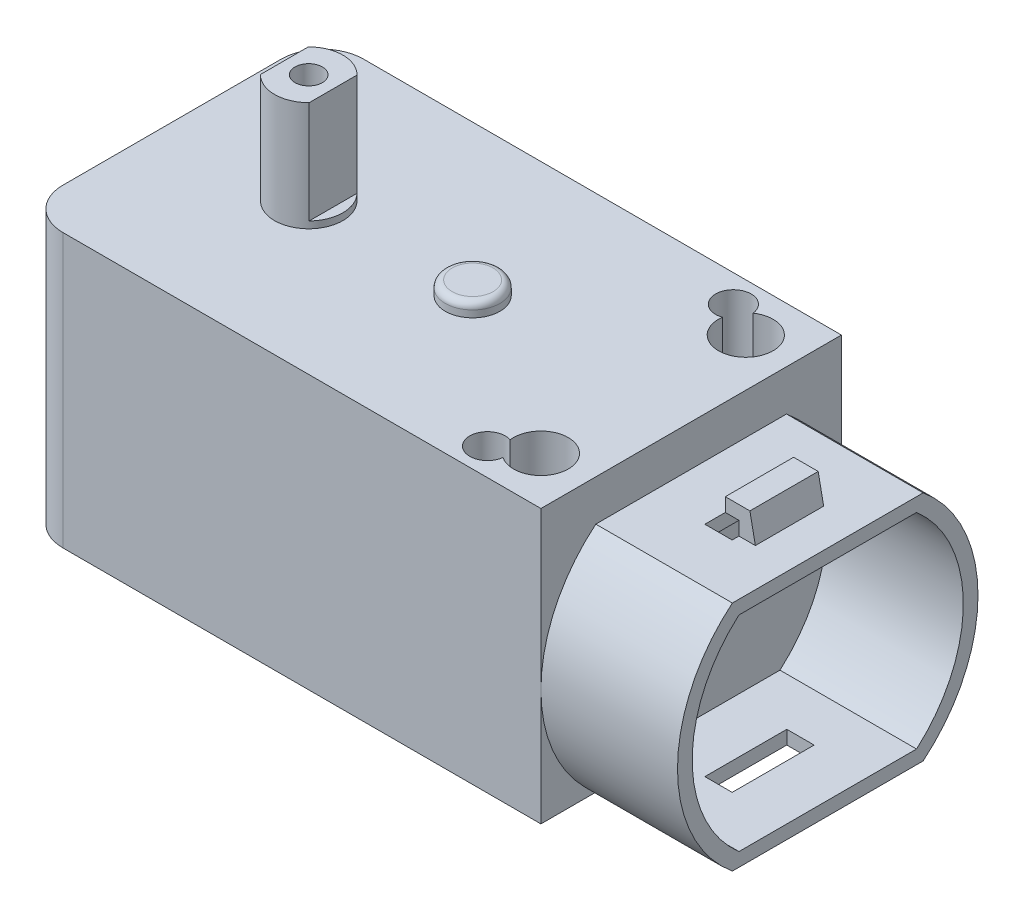
from build123d import *

# Parameters (mm, degrees)
SALIENTE_EXTRUIR1_DEPTH = 10
CROQUIS1_3_W            = 5
CROQUIS1_3_H            = 5
CROQUIS1_3_R            = 1.25
SALIENTE_EXTRUIR2_DEPTH = 1.5
CROQUIS5_R              = 2.5
SALIENTE_EXTRUIR3_DEPTH = 8
CORTAR_EXTRUIR7_START   = -7.5
CORTAR_EXTRUIR7_DEPTH   = 7.5
CROQUIS7_R              = 1
CORTAR_EXTRUIR8_DEPTH   = 36
CORTAR_EXTRUIR18_DEPTH  = 10
CROQUIS9_R              = 1.3
CORTAR_EXTRUIR16_DEPTH  = 36
CROQUIS11_R             = 2
SALIENTE_EXTRUIR4_DEPTH = 1
REDONDEO1_R             = 0.5
CROQUIS12_R             = 0.6
CORTAR_EXTRUIR17_DEPTH  = 9
CROQUIS15_R             = 2
CORTAR_EXTRUIR21_DEPTH  = 5
CROQUIS16_R             = 2.5
CORTAR_EXTRUIR22_DEPTH  = 10
CROQUIS17_W             = 2
CROQUIS17_H             = 6
CORTAR_EXTRUIR23_DEPTH  = 20
SALIENTE_EXTRUIR5_DEPTH = 2.5


with BuildPart() as part:
    # Croquis1 → Saliente-Extruir1 (new, symmetric)
    with BuildSketch(Plane(origin=(0, 0, 0), x_dir=(1, 0, 0), z_dir=(0, 1, 0))):
        with BuildLine():
            ThreePointArc((-24, 8), (-23.121320344, 10.121320344), (-21, 11))
            Line((-21, 11), (24, 11))
            Line((24, 11), (24, -11))
            Line((24, -11), (-21, -11))
            ThreePointArc((-21, -11), (-23.121320344, -10.121320344), (-24, -8))
            Line((-24, -8), (-24, -2.5))
            Line((-24, -2.5), (-24, 2.5))
            Line((-24, 2.5), (-24, 8))
        make_face()
    extrude(amount=SALIENTE_EXTRUIR1_DEPTH, both=True)

    # Croquis1<3> → Saliente-Extruir2 (add, symmetric)
    with BuildSketch(Plane(origin=(0, 0, 0), x_dir=(1, 0, 0), z_dir=(0, 1, 0))):
        with Locations((-26.5, 0)):
            Rectangle(CROQUIS1_3_W, CROQUIS1_3_H)
        with Locations(Location((-26.5, 0, 0), (0, 0, 270))):
            Circle(CROQUIS1_3_R, mode=Mode.SUBTRACT)
    extrude(amount=SALIENTE_EXTRUIR2_DEPTH, both=True)

    # Croquis5 → Saliente-Extruir3 (add)
    with BuildSketch(Plane(origin=(0, 10, 0), x_dir=(1, 0, 0), z_dir=(0, 1, 0))):
        with Locations(Location((-14, 0, 0), (0, 0, 270))):
            Circle(CROQUIS5_R)
    saliente_extruir3 = extrude(amount=SALIENTE_EXTRUIR3_DEPTH)

    # Croquis6 → Cortar-Extruir7 (cut)
    with BuildSketch(Plane(origin=(0, 18, 0), x_dir=(1, 0, 0), z_dir=(0, 1, 0)).offset(CORTAR_EXTRUIR7_START)):
        with BuildLine():
            Line((-15.785357107, 1.75), (-15.785357107, -1.75))
            ThreePointArc((-15.785357107, -1.75), (-16.5, 0), (-15.785357107, 1.75))
        make_face()
        with BuildLine():
            Line((-12.214642893, 1.75), (-12.214642893, -1.75))
            ThreePointArc((-12.214642893, -1.75), (-11.5, 0), (-12.214642893, 1.75))
        make_face()
    cortar_extruir7 = extrude(amount=CORTAR_EXTRUIR7_DEPTH, mode=Mode.SUBTRACT)

    # Simetría2: Saliente-Extruir3, Cortar-Extruir7 across plane
    add(saliente_extruir3.mirror(Plane.ZX))
    add(cortar_extruir7.mirror(Plane.ZX), mode=Mode.SUBTRACT)

    # Croquis7 → Cortar-Extruir8 (cut)
    with BuildSketch(Plane(origin=(0, 18, 0), x_dir=(1, 0, 0), z_dir=(0, 1, 0))):
        with Locations(Location((-14, 0, 0), (0, 0, 270))):
            Circle(CROQUIS7_R)
    extrude(amount=-CORTAR_EXTRUIR8_DEPTH, mode=Mode.SUBTRACT)

    # Croquis13 → Cortar-Extruir18 (cut)
    with BuildSketch(Plane(origin=(24, 0, 0), x_dir=(0, 0, -1), z_dir=(1, 0, 0))):
        with BuildLine():
            Line((-11, 10), (-11, -1.5))
            ThreePointArc((-11, -1.5), (-9.944931378, 3.200887138), (-6.982120022, 7))
            Line((-6.982120022, 7), (6.982120022, 7))
            ThreePointArc((6.982120022, 7), (9.944931392, 3.200887108), (11, -1.500000065))
            Line((11, -1.500000065), (11, 10))
            Line((11, 10), (-11, 10))
        make_face()
        with BuildLine():
            ThreePointArc((11, -1.500000065), (9.944931364, -6.200887167), (6.982120022, -10))
            Line((6.982120022, -10), (11, -10))
            Line((11, -10), (11, -1.500000065))
        make_face()
        with BuildLine():
            Line((0, 6), (-6.5, 6))
            ThreePointArc((-6.5, 6), (-9.924716621, -1.5), (-6.5, -9))
            Line((-6.5, -9), (0, -9))
            Line((0, -9), (0, 6))
        make_face()
        with BuildLine():
            Line((6.5, 6), (0, 6))
            Line((0, 6), (0, -9))
            Line((0, -9), (6.5, -9))
            ThreePointArc((6.5, -9), (9.924716621, -1.5), (6.5, 6))
        make_face()
        with BuildLine():
            Line((-11, -10), (-6.982120022, -10))
            ThreePointArc((-6.982120022, -10), (-9.944931378, -6.200887138), (-11, -1.5))
            Line((-11, -1.5), (-11, -10))
        make_face()
    extrude(amount=-CORTAR_EXTRUIR18_DEPTH, mode=Mode.SUBTRACT)

    # Croquis9 → Cortar-Extruir16 (cut)
    with BuildSketch(Plane(origin=(0, 10, 0), x_dir=(1, 0, 0), z_dir=(0, 1, 0))):
        with Locations(Location((8.091085786, 9, 0), (0, 0, 270))):
            Circle(CROQUIS9_R)
        with Locations(Location((8.091085786, -9, 0), (0, 0, 270))):
            Circle(CROQUIS9_R)
    extrude(amount=-CORTAR_EXTRUIR16_DEPTH, mode=Mode.SUBTRACT)

    # Croquis11 → Saliente-Extruir4 (add)
    with BuildSketch(Plane(origin=(0, 10, 0), x_dir=(1, 0, 0), z_dir=(0, 1, 0))):
        with Locations(Location((-2, 0, 0), (0, 0, 270))):
            Circle(CROQUIS11_R)
    extrude(amount=SALIENTE_EXTRUIR4_DEPTH)

    # Redondeo1
    redondeo1_edges = [part.edges().sort_by_distance(p)[0] for p in [
        (-2, 11, -2),
    ]]
    fillet(redondeo1_edges, radius=REDONDEO1_R)

    # Croquis12 → Cortar-Extruir17 (cut)
    with BuildSketch(Plane.XZ.offset(10)):
        with Locations(Location((-22.030762345, 9.117944486, 0), (0, 0, 270))):
            Circle(CROQUIS12_R)
        with Locations(Location((10.969237655, 9.117944486, 0), (0, 0, 270))):
            Circle(CROQUIS12_R)
        with Locations(Location((10.969237655, -9.117944486, 0), (0, 0, 90))):
            Circle(CROQUIS12_R)
        with Locations(Location((-22.030762345, -9.117944486, 0), (0, 0, 90))):
            Circle(CROQUIS12_R)
    extrude(amount=-CORTAR_EXTRUIR17_DEPTH, mode=Mode.SUBTRACT)

    # Croquis15 → Cortar-Extruir21 (cut)
    with BuildSketch(Plane(origin=(0, 10, 0), x_dir=(1, 0, 0), z_dir=(0, 1, 0))):
        with Locations((10.5, 7.5)):
            Circle(CROQUIS15_R)
        with Locations((10.5, -7.5)):
            Circle(CROQUIS15_R)
    extrude(amount=-CORTAR_EXTRUIR21_DEPTH, mode=Mode.SUBTRACT)

    # Croquis16 → Cortar-Extruir22 (cut)
    with BuildSketch(Plane(origin=(14, 0, 0), x_dir=(0, 0, -1), z_dir=(1, 0, 0))):
        with Locations((0, -1.5)):
            Circle(CROQUIS16_R)
    extrude(amount=-CORTAR_EXTRUIR22_DEPTH, mode=Mode.SUBTRACT)

    # Croquis17 → Cortar-Extruir23 (cut)
    with BuildSketch(Plane(origin=(0, 7, 0), x_dir=(1, 0, 0), z_dir=(0, 1, 0))):
        with Locations((19, 0.002120022)):
            Rectangle(CROQUIS17_W, CROQUIS17_H)
    extrude(amount=-CORTAR_EXTRUIR23_DEPTH, mode=Mode.SUBTRACT)

    # Croquis18 → Saliente-Extruir5 (add, symmetric)
    with BuildSketch(Plane.XY):
        Polygon((21.2, 7), (20.8, 9), (19, 9), (19, 8), (20, 8), (20, 7), align=None)
    saliente_extruir5 = extrude(amount=SALIENTE_EXTRUIR5_DEPTH, both=True)

    # Simetría3: Saliente-Extruir5 across plane
    add(saliente_extruir5.mirror(Plane.ZX.offset(-1.5)))


solid = part.part
